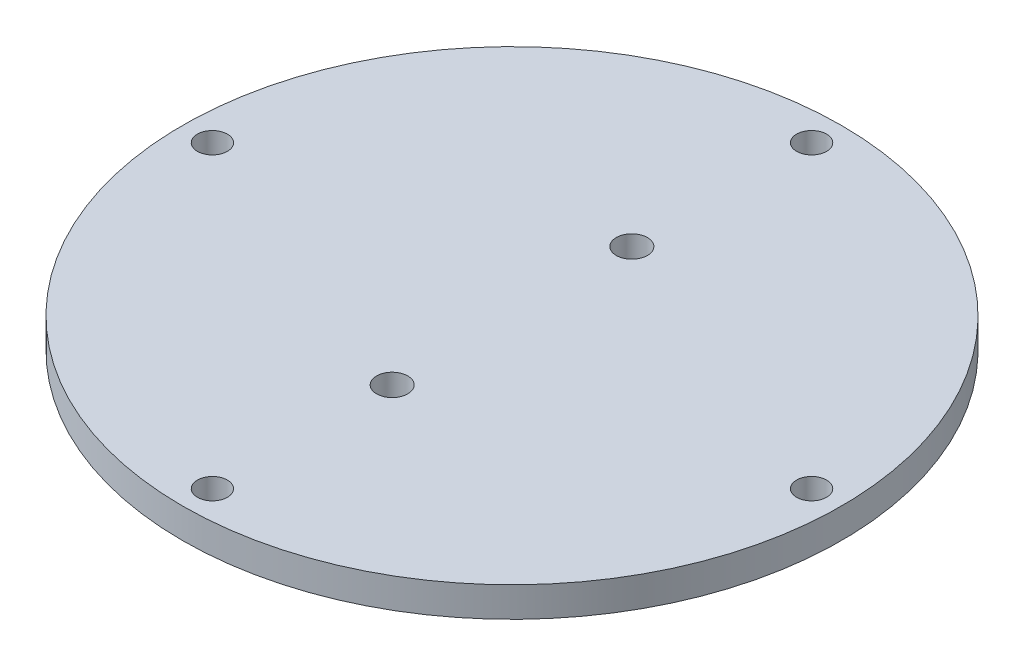
from build123d import *

# Parameters (mm, degrees)
SKETCH1_R           = 55
SKETCH1_R_2         = 2.6
SKETCH1_R_3         = 2.5
BOSS_EXTRUDE1_DEPTH = 5


with BuildPart() as part:
    # Sketch1 → Boss-Extrude1 (new body)
    with BuildSketch(Plane(origin=(0, 0, 0), x_dir=(1, 0, 0), z_dir=(0, 1, 0))):
        with Locations(Location((0, 0, 0), (0, 0, 270))):
            Circle(SKETCH1_R)
        with Locations(Location((0, 20, 0), (0, 0, 270))):
            Circle(SKETCH1_R_2, mode=Mode.SUBTRACT)
        with Locations(Location((0, -20, 0), (0, 0, 90))):
            Circle(SKETCH1_R_2, mode=Mode.SUBTRACT)
        with Locations(Location((0, 50, 0), (0, 0, 270))):
            Circle(SKETCH1_R_3, mode=Mode.SUBTRACT)
        with Locations(Location((50, 0, 0), (0, 0, 270))):
            Circle(SKETCH1_R_3, mode=Mode.SUBTRACT)
        with Locations(Location((0, -50, 0), (0, 0, 270))):
            Circle(SKETCH1_R_3, mode=Mode.SUBTRACT)
        with Locations(Location((-50, 0, 0), (0, 0, 270))):
            Circle(SKETCH1_R_3, mode=Mode.SUBTRACT)
    extrude(amount=BOSS_EXTRUDE1_DEPTH)


solid = part.part
